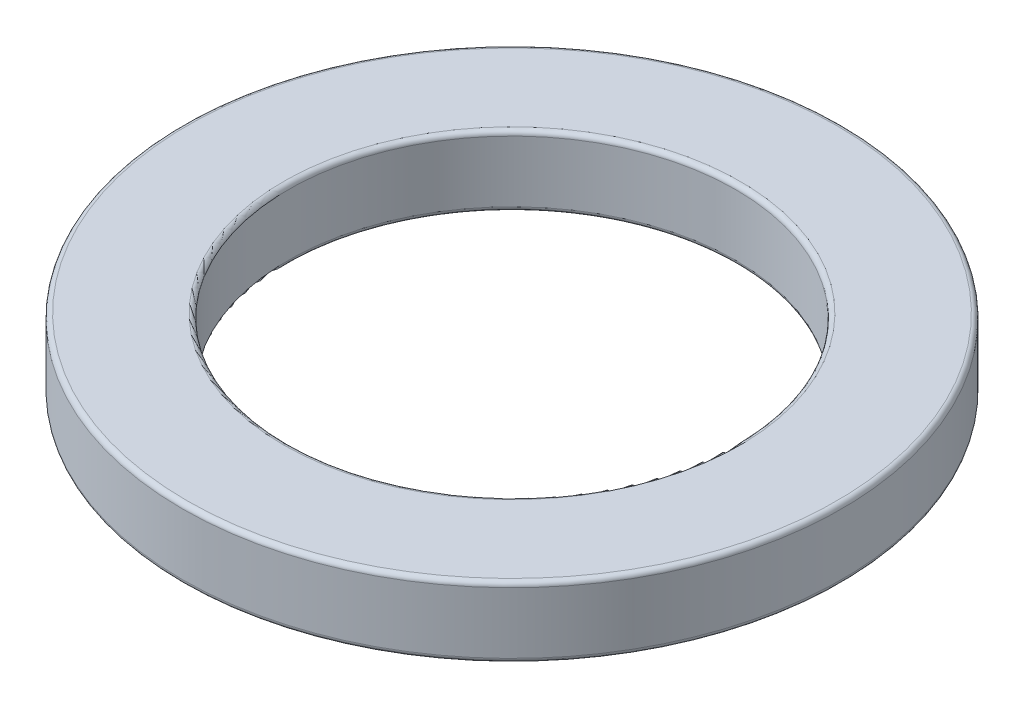
from build123d import *

# Parameters (mm, degrees)
SKETCH1_R           = 14
SKETCH1_R_2         = 9.5
BOSS_EXTRUDE1_DEPTH = 3
FILLET1_R           = 0.2


with BuildPart() as part:
    # Sketch1 → Boss-Extrude1 (new body)
    with BuildSketch(Plane(origin=(0, 0, 0), x_dir=(1, 0, 0), z_dir=(0, 1, 0))):
        with Locations(Location((0, 0, 0), (0, 0, 270))):
            Circle(SKETCH1_R)
        with Locations(Location((0, 0, 0), (0, 0, 270))):
            Circle(SKETCH1_R_2, mode=Mode.SUBTRACT)
    extrude(amount=BOSS_EXTRUDE1_DEPTH)

    # Fillet1
    fillet1_edges = [part.edges().sort_by_distance(p)[0] for p in [
        (0, 0, -14),
        (0, 3, -14),
        (0, 0, -9.5),
        (0, 3, -9.5),
    ]]
    fillet(fillet1_edges, radius=FILLET1_R)


solid = part.part
